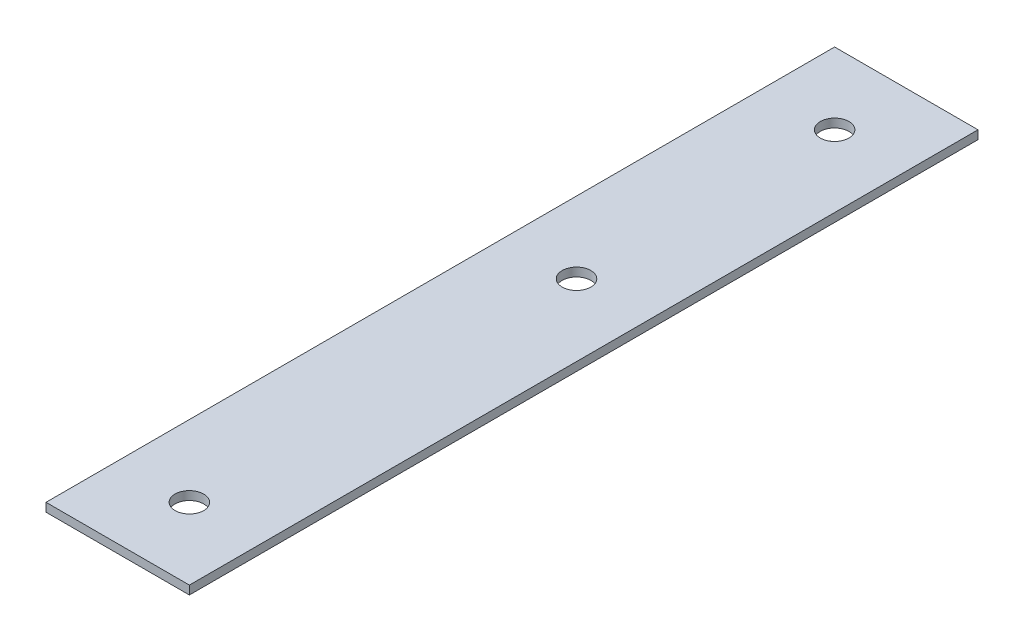
from build123d import *

# Parameters (mm, degrees)
SKETCH1_W           = 50
SKETCH1_H           = 275
BOSS_EXTRUDE1_DEPTH = 3
SKETCH2_R           = 5
CUT_EXTRUDE1_DEPTH  = 280.524596413


with BuildPart() as part:
    # Sketch1 → Boss-Extrude1 (new body)
    with BuildSketch(Plane(origin=(0, 0, 0), x_dir=(1, 0, 0), z_dir=(0, 1, 0))):
        with Locations((25, 137.5)):
            Rectangle(SKETCH1_W, SKETCH1_H)
    extrude(amount=BOSS_EXTRUDE1_DEPTH)

    # Sketch2 → Cut-Extrude1 (cut, through all)
    with BuildSketch(Plane(origin=(0, 3, 0), x_dir=(1, 0, 0), z_dir=(0, 1, 0))):
        with Locations(Location((25, 250, 0), (0, 0, 270))):
            Circle(SKETCH2_R)
        with Locations(Location((25, 25, 0), (0, 0, 270))):
            Circle(SKETCH2_R)
        with Locations(Location((25, 160, 0), (0, 0, 270))):
            Circle(SKETCH2_R)
    extrude(amount=-CUT_EXTRUDE1_DEPTH, mode=Mode.SUBTRACT)


solid = part.part
